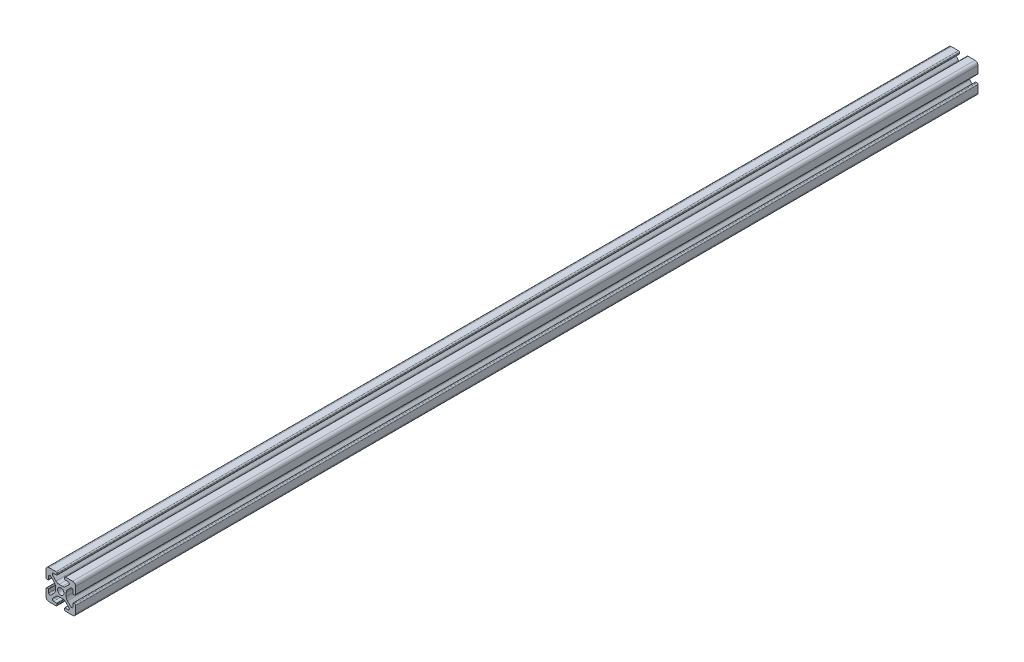
from build123d import *

# Parameters (mm, degrees)
SKETCH1_R           = 2.1463
BOSS_EXTRUDE1_DEPTH = 304.8


with BuildPart() as part:
    # Sketch1 → Boss-Extrude1 (new, symmetric)
    with BuildSketch(Plane.XY):
        with BuildLine():
            Line((-9.9949, 7.9883), (-9.9949, 3.2893))
            ThreePointArc((-9.9949, 3.2893), (-9.76427588, 2.73252412), (-9.2075, 2.5019))
            Line((-9.2075, 2.5019), (-8.4963, 2.5019))
            ThreePointArc((-8.4963, 2.5019), (-8.280773853, 2.591173853), (-8.1915, 2.8067))
            Line((-8.1915, 2.8067), (-8.1915, 4.9149))
            ThreePointArc((-8.1915, 4.9149), (-7.674065253, 5.689295824), (-6.760603096, 5.507596904))
            Line((-6.760603096, 5.507596904), (-4.505765747, 3.252759555))
            ThreePointArc((-4.505765747, 3.252759555), (-3.856054457, 2.280397894), (-3.627906192, 1.133419111))
            Line((-3.627906192, 1.133419111), (-3.627906192, -1.133419111))
            ThreePointArc((-3.627906192, -1.133419111), (-3.856054457, -2.280397894), (-4.505765747, -3.252759555))
            Line((-4.505765747, -3.252759555), (-6.760603096, -5.507596904))
            ThreePointArc((-6.760603096, -5.507596904), (-7.674065253, -5.689295824), (-8.1915, -4.9149))
            Line((-8.1915, -4.9149), (-8.1915, -2.8067))
            ThreePointArc((-8.1915, -2.8067), (-8.280773853, -2.591173853), (-8.4963, -2.5019))
            Line((-8.4963, -2.5019), (-9.2075, -2.5019))
            ThreePointArc((-9.2075, -2.5019), (-9.76427588, -2.73252412), (-9.9949, -3.2893))
            Line((-9.9949, -3.2893), (-9.9949, -7.9883))
            ThreePointArc((-9.9949, -7.9883), (-9.407180467, -9.407180467), (-7.9883, -9.9949))
            Line((-7.9883, -9.9949), (-3.2893, -9.9949))
            ThreePointArc((-3.2893, -9.9949), (-2.73252412, -9.76427588), (-2.5019, -9.2075))
            Line((-2.5019, -9.2075), (-2.5019, -8.4963))
            ThreePointArc((-2.5019, -8.4963), (-2.591173853, -8.280773853), (-2.8067, -8.1915))
            Line((-2.8067, -8.1915), (-4.9149, -8.1915))
            ThreePointArc((-4.9149, -8.1915), (-5.689295824, -7.674065253), (-5.507596904, -6.760603096))
            Line((-5.507596904, -6.760603096), (-3.252759555, -4.505765747))
            ThreePointArc((-3.252759555, -4.505765747), (-2.280397894, -3.856054457), (-1.133419111, -3.627906192))
            Line((-1.133419111, -3.627906192), (1.133419111, -3.627906192))
            ThreePointArc((1.133419111, -3.627906192), (2.280397894, -3.856054457), (3.252759555, -4.505765747))
            Line((3.252759555, -4.505765747), (5.507596904, -6.760603096))
            ThreePointArc((5.507596904, -6.760603096), (5.689295824, -7.674065253), (4.9149, -8.1915))
            Line((4.9149, -8.1915), (2.8067, -8.1915))
            ThreePointArc((2.8067, -8.1915), (2.591173853, -8.280773853), (2.5019, -8.4963))
            Line((2.5019, -8.4963), (2.5019, -9.2075))
            ThreePointArc((2.5019, -9.2075), (2.73252412, -9.76427588), (3.2893, -9.9949))
            Line((3.2893, -9.9949), (7.9883, -9.9949))
            ThreePointArc((7.9883, -9.9949), (9.407180467, -9.407180467), (9.9949, -7.9883))
            Line((9.9949, -7.9883), (9.9949, -3.2893))
            ThreePointArc((9.9949, -3.2893), (9.76427588, -2.73252412), (9.2075, -2.5019))
            Line((9.2075, -2.5019), (8.4963, -2.5019))
            ThreePointArc((8.4963, -2.5019), (8.280773853, -2.591173853), (8.1915, -2.8067))
            Line((8.1915, -2.8067), (8.1915, -4.9149))
            ThreePointArc((8.1915, -4.9149), (7.674065253, -5.689295824), (6.760603096, -5.507596904))
            Line((6.760603096, -5.507596904), (4.505765747, -3.252759555))
            ThreePointArc((4.505765747, -3.252759555), (3.856054457, -2.280397894), (3.627906192, -1.133419111))
            Line((3.627906192, -1.133419111), (3.627906192, 1.133419111))
            ThreePointArc((3.627906192, 1.133419111), (3.856054457, 2.280397894), (4.505765747, 3.252759555))
            Line((4.505765747, 3.252759555), (6.760603096, 5.507596904))
            ThreePointArc((6.760603096, 5.507596904), (7.674065253, 5.689295824), (8.1915, 4.9149))
            Line((8.1915, 4.9149), (8.1915, 2.8067))
            ThreePointArc((8.1915, 2.8067), (8.280773853, 2.591173853), (8.4963, 2.5019))
            Line((8.4963, 2.5019), (9.2075, 2.5019))
            ThreePointArc((9.2075, 2.5019), (9.76427588, 2.73252412), (9.9949, 3.2893))
            Line((9.9949, 3.2893), (9.9949, 7.9883))
            ThreePointArc((9.9949, 7.9883), (9.407180467, 9.407180467), (7.9883, 9.9949))
            Line((7.9883, 9.9949), (3.2893, 9.9949))
            ThreePointArc((3.2893, 9.9949), (2.73252412, 9.76427588), (2.5019, 9.2075))
            Line((2.5019, 9.2075), (2.5019, 8.4963))
            ThreePointArc((2.5019, 8.4963), (2.591173853, 8.280773853), (2.8067, 8.1915))
            Line((2.8067, 8.1915), (4.9149, 8.1915))
            ThreePointArc((4.9149, 8.1915), (5.689295824, 7.674065253), (5.507596904, 6.760603096))
            Line((5.507596904, 6.760603096), (3.252759555, 4.505765747))
            ThreePointArc((3.252759555, 4.505765747), (2.280397894, 3.856054457), (1.133419111, 3.627906192))
            Line((1.133419111, 3.627906192), (-1.133419111, 3.627906192))
            ThreePointArc((-1.133419111, 3.627906192), (-2.280397894, 3.856054457), (-3.252759555, 4.505765747))
            Line((-3.252759555, 4.505765747), (-5.507596904, 6.760603096))
            ThreePointArc((-5.507596904, 6.760603096), (-5.689295824, 7.674065253), (-4.9149, 8.1915))
            Line((-4.9149, 8.1915), (-2.8067, 8.1915))
            ThreePointArc((-2.8067, 8.1915), (-2.591173853, 8.280773853), (-2.5019, 8.4963))
            Line((-2.5019, 8.4963), (-2.5019, 9.2075))
            ThreePointArc((-2.5019, 9.2075), (-2.73252412, 9.76427588), (-3.2893, 9.9949))
            Line((-3.2893, 9.9949), (-7.9883, 9.9949))
            ThreePointArc((-7.9883, 9.9949), (-9.407180467, 9.407180467), (-9.9949, 7.9883))
        make_face()
        with Locations(Location((0, 0, 0), (0, 0, 180))):
            Circle(SKETCH1_R, mode=Mode.SUBTRACT)
    extrude(amount=BOSS_EXTRUDE1_DEPTH, both=True)


solid = part.part
